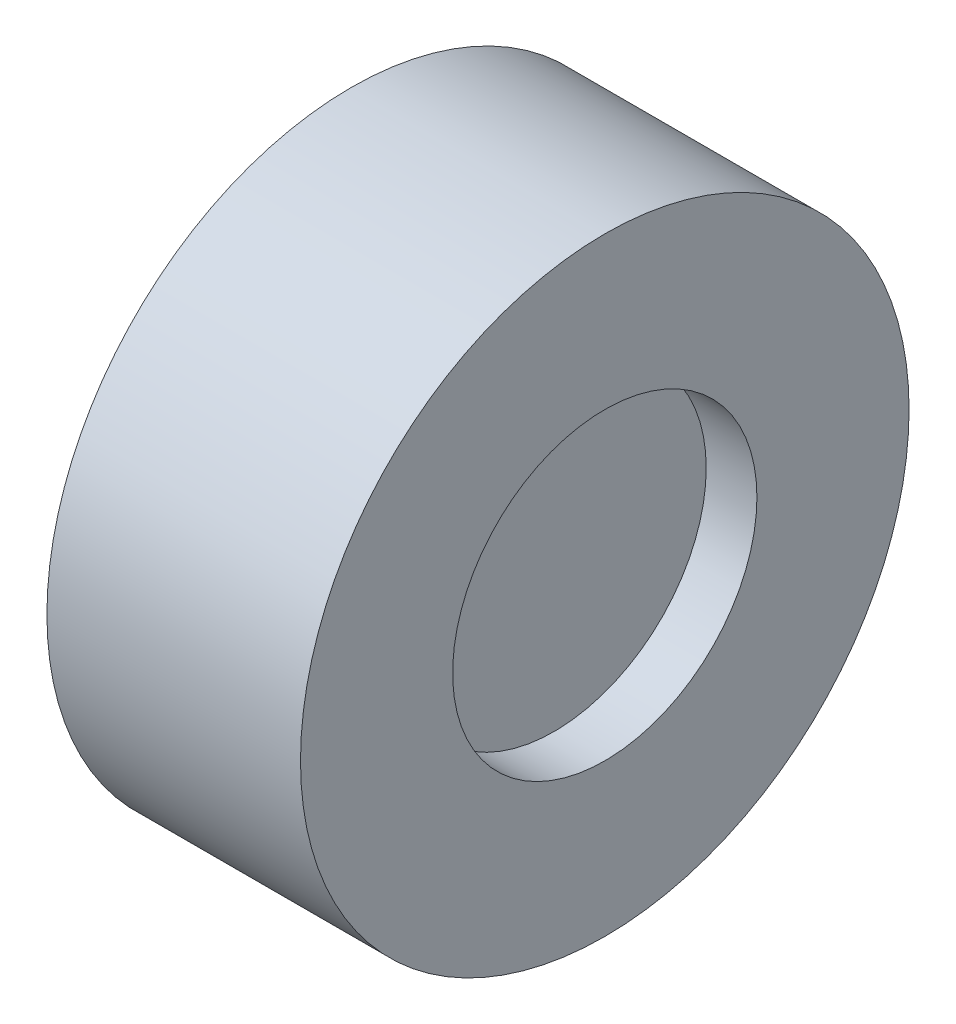
from build123d import *

# Parameters (mm, degrees)
SKETCH1_R           = 12
BOSS_EXTRUDE1_DEPTH = 10
SKETCH2_R           = 1.5
CUT_EXTRUDE1_DEPTH  = 0.5
SKETCH3_R           = 6
CUT_EXTRUDE2_DEPTH  = 2


with BuildPart() as part:
    # Sketch1 → Boss-Extrude1 (new body)
    with BuildSketch(Plane(origin=(0, 0, 0), x_dir=(0, 0, -1), z_dir=(1, 0, 0))):
        Circle(SKETCH1_R)
    extrude(amount=BOSS_EXTRUDE1_DEPTH)

    # Sketch2 → Cut-Extrude1 (cut)
    with BuildSketch(Plane.ZY):
        Circle(SKETCH2_R)
    extrude(amount=-CUT_EXTRUDE1_DEPTH, mode=Mode.SUBTRACT)

    # Sketch3 → Cut-Extrude2 (cut)
    with BuildSketch(Plane(origin=(10, 0, 0), x_dir=(0, 0, -1), z_dir=(1, 0, 0))):
        Circle(SKETCH3_R)
    extrude(amount=-CUT_EXTRUDE2_DEPTH, mode=Mode.SUBTRACT)


solid = part.part
